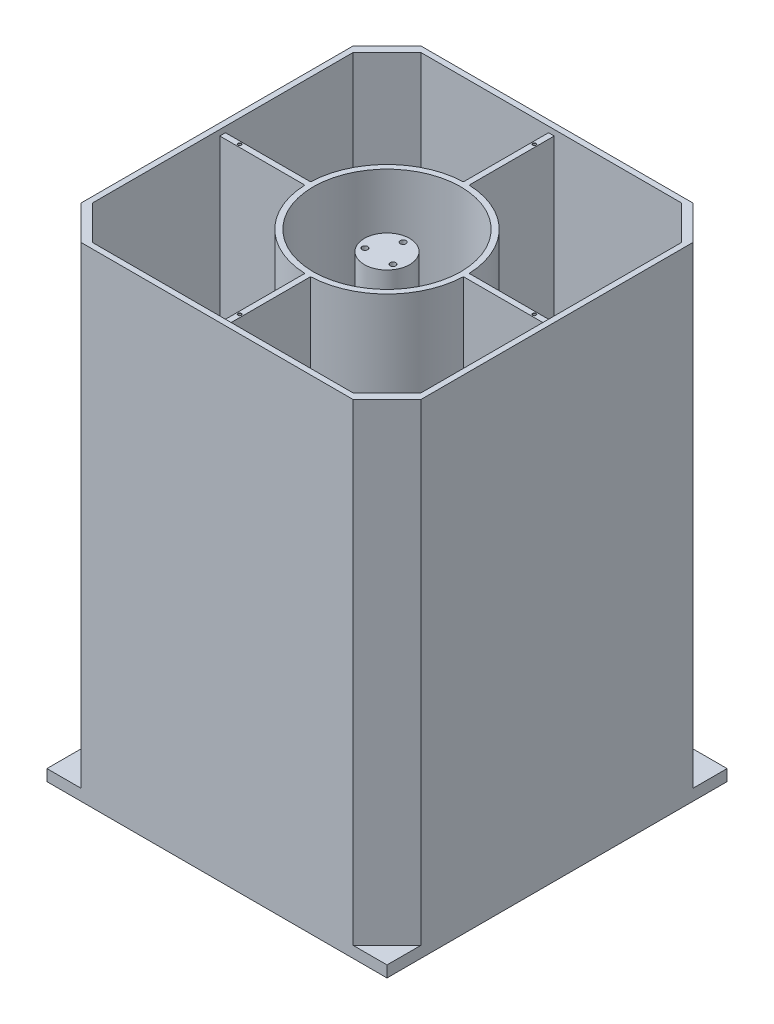
from build123d import *

# Parameters (mm, degrees)
SKETCH1_W                   = 300
SKETCH1_H                   = 300
SKETCH1_R                   = 17.5
BOSS_EXTRUDE1_DEPTH         = 10
SKETCH1_3_R                 = 65
SKETCH1_3_R_2               = 62.5
BOSS_EXTRUDE2_DEPTH         = 292
SKETCH1_4_R                 = 70
SKETCH1_4_R_2               = 65
BOSS_EXTRUDE3_DEPTH         = 422
SKETCH1_5_R                 = 20
SKETCH1_5_R_2               = 17.5
BOSS_EXTRUDE4_DEPTH         = 405
BOSS_EXTRUDE5_START         = -5
SKETCH3_R                   = 20
BOSS_EXTRUDE5_DEPTH         = 5
SKETCH4_R                   = 2.5
CUT_EXTRUDE1_DEPTH          = 5
BOSS_EXTRUDE6_DEPTH         = 427
RIB3_REACH                  = 474.318
SKETCH7_WALLS_W             = 1023.664705026
SKETCH7_WALLS_H             = 5
SKETCH7_WALLS_W_2           = 1024.247045089
SKETCH7_WALLS_W_3           = 5
SKETCH7_WALLS_H_2           = 1023.987417205
SKETCH7_WALLS_H_3           = 1024.344484495
M3_TAPPED_HOLE1_D           = 2.5
M3_TAPPED_HOLE1_DEPTH       = 7.5
M3_TAPPED_HOLE1_CSINK_D     = 3.05
M3_TAPPED_HOLE1_CSINK_ANGLE = 90
M3_TAPPED_HOLE1_TIP         = 0.751075774
SKETCH1_6_R                 = 62.5
SKETCH1_6_R_2               = 55
BOSS_EXTRUDE7_DEPTH         = 272


with BuildPart() as part:
    # Sketch1 → Boss-Extrude1 (new body)
    with BuildSketch(Plane(origin=(0, 0, 0), x_dir=(1, 0, 0), z_dir=(0, 1, 0))):
        Rectangle(SKETCH1_W, SKETCH1_H)
        Circle(SKETCH1_R, mode=Mode.SUBTRACT)
    extrude(amount=BOSS_EXTRUDE1_DEPTH)

    # Sketch1<3> → Boss-Extrude2 (add)
    with BuildSketch(Plane(origin=(0, 0, 0), x_dir=(1, 0, 0), z_dir=(0, 1, 0))):
        Circle(SKETCH1_3_R)
        Circle(SKETCH1_3_R_2, mode=Mode.SUBTRACT)
    extrude(amount=BOSS_EXTRUDE2_DEPTH)

    # Sketch1<4> → Boss-Extrude3 (add)
    with BuildSketch(Plane(origin=(0, 0, 0), x_dir=(1, 0, 0), z_dir=(0, 1, 0))):
        Circle(SKETCH1_4_R)
        Circle(SKETCH1_4_R_2, mode=Mode.SUBTRACT)
    extrude(amount=BOSS_EXTRUDE3_DEPTH)

    # Sketch1<5> → Boss-Extrude4 (add)
    with BuildSketch(Plane(origin=(0, 0, 0), x_dir=(1, 0, 0), z_dir=(0, 1, 0))):
        Circle(SKETCH1_5_R)
        Circle(SKETCH1_5_R_2, mode=Mode.SUBTRACT)
    extrude(amount=BOSS_EXTRUDE4_DEPTH)

    # Sketch3 → Boss-Extrude5 (add)
    with BuildSketch(Plane(origin=(0, 405, 0), x_dir=(1, 0, 0), z_dir=(0, 1, 0)).offset(BOSS_EXTRUDE5_START)):
        Circle(SKETCH3_R)
    extrude(amount=BOSS_EXTRUDE5_DEPTH)

    # Sketch4 → Cut-Extrude1 (cut)
    with BuildSketch(Plane(origin=(0, 405, 0), x_dir=(1, 0, 0), z_dir=(0, 1, 0))):
        with Locations((0, 14.25)):
            Circle(SKETCH4_R)
        with Locations((12.340862004, -7.125)):
            Circle(SKETCH4_R)
        with Locations((-12.340862004, -7.125)):
            Circle(SKETCH4_R)
    extrude(amount=-CUT_EXTRUDE1_DEPTH, mode=Mode.SUBTRACT)

    # Sketch6 → Boss-Extrude6 (add)
    with BuildSketch(Plane(origin=(0, 0, 0), x_dir=(1, 0, 0), z_dir=(0, 1, 0))):
        Polygon((-120, 150), (120, 150), (150, 120), (150, -120), (120, -150), (-120, -150), (-150, -120), (-150, 120), align=None)
        Polygon((115, 145), (145, 115), (145, -115), (115, -145), (-115, -145), (-145, -115), (-145, 115), (-115, 145), align=None, mode=Mode.SUBTRACT)
    extrude(amount=BOSS_EXTRUDE6_DEPTH)

    # Sketch7 walls → Rib3 (add, up to next)
    with BuildSketch(Plane(origin=(0, 422, 0), x_dir=(1, 0, 0), z_dir=(0, 1, 0)), mode=Mode.PRIVATE) as rib3_sk1:
        with Locations((106.485337183, 0)):
            Rectangle(SKETCH7_WALLS_W, SKETCH7_WALLS_H)
    rib3_tool1 = extrude(rib3_sk1.sketch, amount=-RIB3_REACH, mode=Mode.PRIVATE) - part.part
    # Sketch7 walls → Rib3 (add, up to next)
    with BuildSketch(Plane(origin=(0, 422, 0), x_dir=(1, 0, 0), z_dir=(0, 1, 0)), mode=Mode.PRIVATE) as rib3_sk2:
        with Locations((-106.194167151, 0)):
            Rectangle(SKETCH7_WALLS_W_2, SKETCH7_WALLS_H)
    rib3_tool2 = extrude(rib3_sk2.sketch, amount=-RIB3_REACH, mode=Mode.PRIVATE) - part.part
    # Sketch7 walls → Rib3 (add, up to next)
    with BuildSketch(Plane(origin=(0, 422, 0), x_dir=(1, 0, 0), z_dir=(0, 1, 0)), mode=Mode.PRIVATE) as rib3_sk3:
        with Locations((0, 106.323981093)):
            Rectangle(SKETCH7_WALLS_W_3, SKETCH7_WALLS_H_2)
    rib3_tool3 = extrude(rib3_sk3.sketch, amount=-RIB3_REACH, mode=Mode.PRIVATE) - part.part
    # Sketch7 walls → Rib3 (add, up to next)
    with BuildSketch(Plane(origin=(0, 422, 0), x_dir=(1, 0, 0), z_dir=(0, 1, 0)), mode=Mode.PRIVATE) as rib3_sk4:
        with Locations((0, -106.145447448)):
            Rectangle(SKETCH7_WALLS_W_3, SKETCH7_WALLS_H_3)
    rib3_tool4 = extrude(rib3_sk4.sketch, amount=-RIB3_REACH, mode=Mode.PRIVATE) - part.part
    add(rib3_tool1.solids().sort_by_distance((106.485337183, 422, 0))[0])
    add(rib3_tool2.solids().sort_by_distance((-106.194167152, 422, 0))[0])
    add(rib3_tool3.solids().sort_by_distance((0, 422, -106.323981094))[0])
    add(rib3_tool4.solids().sort_by_distance((0, 422, 106.145447449))[0])

    # M3 Tapped Hole1
    with Locations(Plane(origin=(0, 422, 0), x_dir=(1, 0, 0), z_dir=(0, 1, 0))):
        with Locations((0, 130), (130, 0), (0, -130), (-130, 0)):
            CounterSinkHole(M3_TAPPED_HOLE1_D / 2, M3_TAPPED_HOLE1_CSINK_D / 2, depth=M3_TAPPED_HOLE1_DEPTH, counter_sink_angle=M3_TAPPED_HOLE1_CSINK_ANGLE)
            with Locations((0, 0, -(M3_TAPPED_HOLE1_DEPTH + M3_TAPPED_HOLE1_TIP / 2))):  # 118° drill point
                Cone(0, M3_TAPPED_HOLE1_D / 2, M3_TAPPED_HOLE1_TIP, mode=Mode.SUBTRACT)

    # Sketch1<6> → Boss-Extrude7 (add)
    with BuildSketch(Plane(origin=(0, 0, 0), x_dir=(1, 0, 0), z_dir=(0, 1, 0))):
        Circle(SKETCH1_6_R)
        Circle(SKETCH1_6_R_2, mode=Mode.SUBTRACT)
    extrude(amount=BOSS_EXTRUDE7_DEPTH)


solid = part.part
